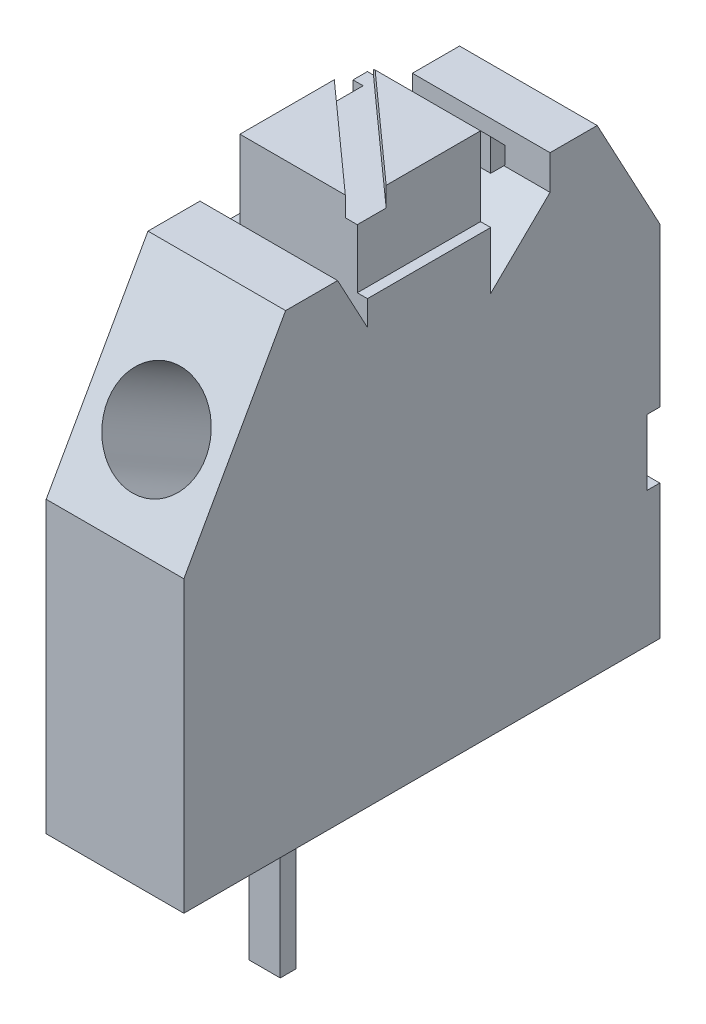
from build123d import *

# Parameters (mm, degrees)
SKETCH_1_W          = 3.5
SKETCH_1_H          = 12.1
EXTRUDE_1_DEPTH     = 13.2
SKETCH_2_W          = 0.330714911
SKETCH_2_H          = 1.671791026
CUT_EXTRUDE_1_DEPTH = 13.2
SKETCH_8_W          = 0.257824974
SKETCH_8_H          = 3.133485684
CUT_EXTRUDE_4_DEPTH = 2
SKETCH_4_R          = 1.25
CUT_EXTRUDE_2_DEPTH = 5
CUT_EXTRUDE_3_DEPTH = 0.5
SKETCH_6_W          = 0.8
SKETCH_6_H          = 0.4
EXTRUDE_1424_DEPTH  = 4


with BuildPart() as part:
    # 草图1 → 凸台-拉伸1 (new body)
    with BuildSketch(Plane(origin=(0, 0, 0), x_dir=(1, 0, 0), z_dir=(0, 1, 0))):
        Rectangle(SKETCH_1_W, SKETCH_1_H)
    extrude(amount=EXTRUDE_1_DEPTH)

    # 草图2 → 切除-拉伸1 (cut)
    with BuildSketch(Plane.ZY.offset(1.75)):
        with Locations((-5.884642545, 4.259492563)):
            Rectangle(SKETCH_2_W, SKETCH_2_H)
        Polygon((-4.4584027, 12.092198582), (-6.05, 9.129739953), (-6.05, 13.2), (-1.750507475, 13.2), (-2.117021791, 12.824491726), (-2.117021791, 12.39177305), (-1.750507475, 12.39177305), (-1.750507475, 9.747762053), (-3.260104827, 11.218439716), (-3.260104827, 12.092198582), align=None)
        Polygon((1.382978209, 13.2), (1.382978209, 10.565811036), (2.140809297, 11.977057019), (3.463073776, 11.977057019), (6.05, 7.365579196), (6.05, 13.2), align=None)
    extrude(amount=-CUT_EXTRUDE_1_DEPTH, mode=Mode.SUBTRACT)

    # 草图8 → 切除-拉伸4 (cut)
    with BuildSketch(Plane(origin=(0, 13.2, 0), x_dir=(1, 0, 0), z_dir=(0, 1, 0))):
        with Locations((1.621087513, 0.183764633)):
            Rectangle(SKETCH_8_W, SKETCH_8_H)
        with Locations((-1.621087513, 0.183764633)):
            Rectangle(SKETCH_8_W, SKETCH_8_H)
    extrude(amount=-CUT_EXTRUDE_4_DEPTH, mode=Mode.SUBTRACT)

    # 草图4 → 切除-拉伸2 (cut)
    with BuildSketch(Plane(origin=(0, 4.344588307, 7.744701971), x_dir=(1, 0, 0), z_dir=(0, 0.4892509225965462, 0.8721430701085852))):
        with Locations(Location((0, 5.619309483, 0), (0, 0, 270))):
            Circle(SKETCH_4_R)
    extrude(amount=-CUT_EXTRUDE_2_DEPTH, mode=Mode.SUBTRACT)

    # 草图5 → 切除-拉伸3 (cut)
    with BuildSketch(Plane(origin=(0, 13.2, 0), x_dir=(1, 0, 0), z_dir=(0, 1, 0))):
        Polygon((-2.244287714, 1.689705222), (-1.702195493, 2.211037938), (2.310317802, -1.381291481), (1.810052614, -1.94007117), align=None)
    extrude(amount=-CUT_EXTRUDE_3_DEPTH, mode=Mode.SUBTRACT)

    # 草图6 → Extrude 1424 (add)
    with BuildSketch(Plane.XZ):
        with Locations((0, 2.05)):
            Rectangle(SKETCH_6_W, SKETCH_6_H)
    extrude(amount=EXTRUDE_1424_DEPTH)


solid = part.part
